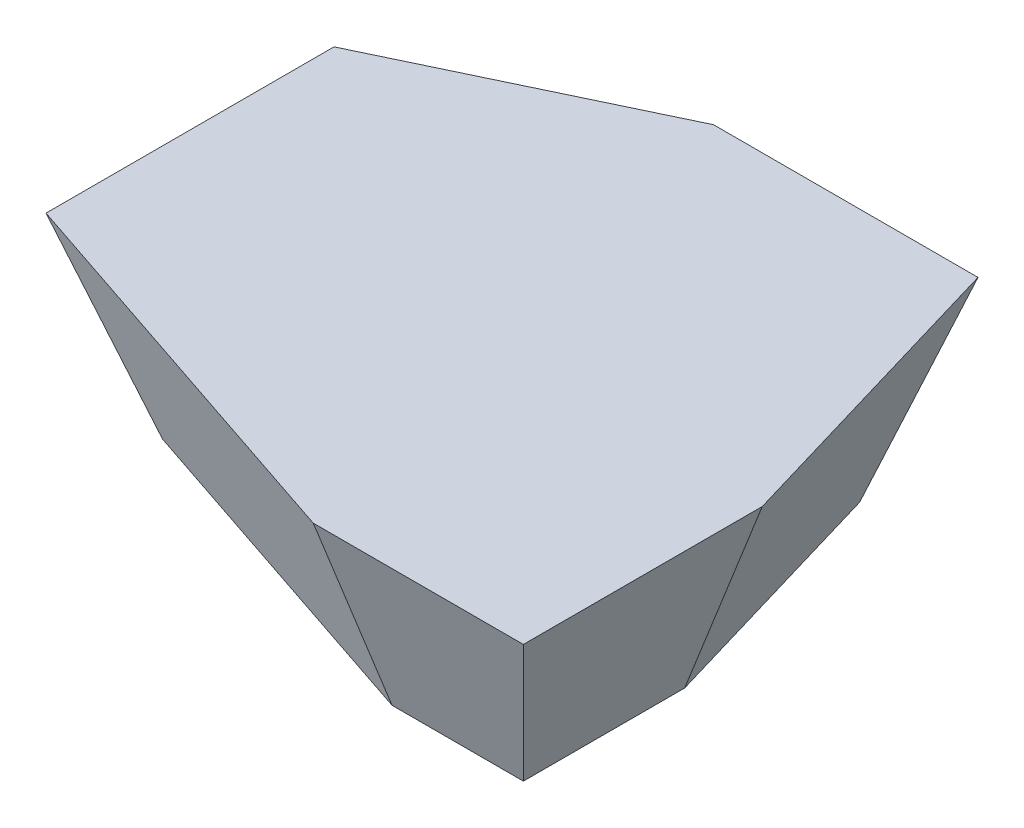
from build123d import *

# Parameters (mm, degrees)
EXTRUDE_1_DEPTH = 25
DRAFT_1_ANGLE   = 20


with BuildPart() as part:
    # 草图1 → 凸台-拉伸1 (new body)
    with BuildSketch(Plane(origin=(0, 0, 0), x_dir=(1, 0, 0), z_dir=(0, 1, 0))):
        Polygon((-61.640527642, 14.993641859), (-61.640527642, -11.384061411), (-15.271301893, -26.933023339), (2.359472358, -26.933023339), (2.359472358, -5.275540654), (-7.496820929, 28.066976661), (-34.152184234, 28.066976661), align=None)
    extrude(amount=EXTRUDE_1_DEPTH)

    # 拔模1
    draft_1_faces = [part.faces().sort_by_distance(p)[0] for p in [
        (-38.455914768, 12.5, 19.158542375),
        (-61.640527642, 12.5, -1.804790224),
        (-47.896355938, 12.5, -21.53030926),
        (-20.824502582, 12.5, -28.066976661),
        (-2.568674286, 12.5, -11.395718003),
        (2.359472358, 12.5, 16.104281997),
        (-6.455914768, 12.5, 26.933023339),
    ]]
    draft(draft_1_faces, Plane(origin=(0, 0, 0), x_dir=(0, 0, -1), z_dir=(0, -1, 0)), DRAFT_1_ANGLE)


solid = part.part
